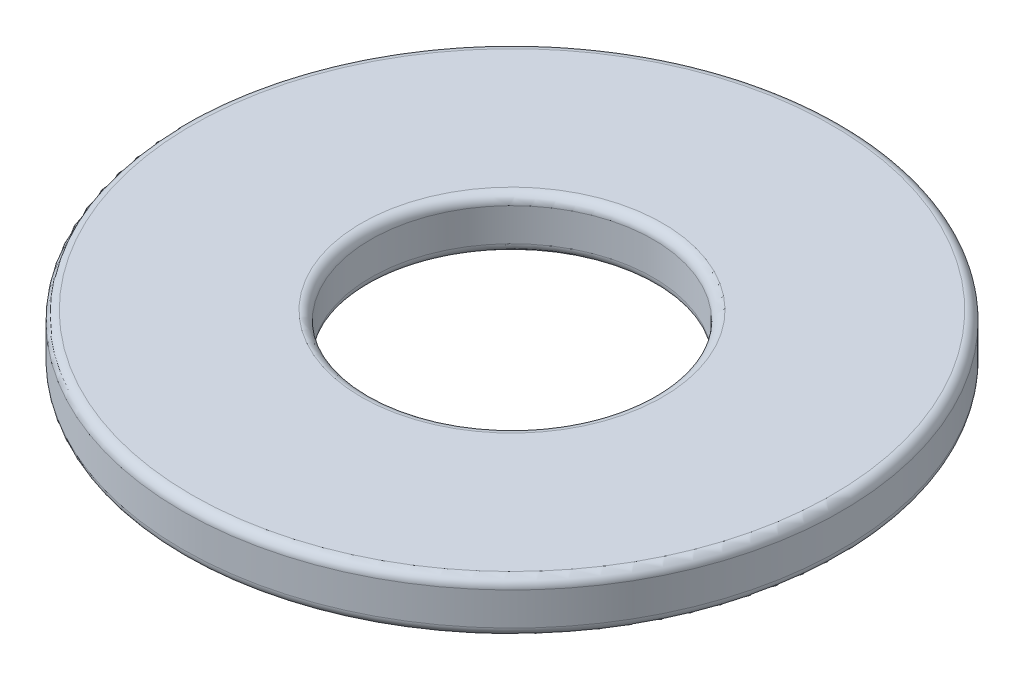
from build123d import *

# Parameters (mm, degrees)
SKETCH1_R           = 3.5
SKETCH1_R_2         = 1.5
BOSS_EXTRUDE1_DEPTH = 0.55
FILLET1_R           = 0.1


with BuildPart() as part:
    # Sketch1 → Boss-Extrude1 (new body)
    with BuildSketch(Plane(origin=(0, 0, 0), x_dir=(1, 0, 0), z_dir=(0, 1, 0))):
        with Locations(Location((0, 0, 0), (0, 0, 270))):
            Circle(SKETCH1_R)
        with Locations(Location((0, 0, 0), (0, 0, 270))):
            Circle(SKETCH1_R_2, mode=Mode.SUBTRACT)
    extrude(amount=BOSS_EXTRUDE1_DEPTH)

    # Fillet1
    fillet1_edges = [part.edges().sort_by_distance(p)[0] for p in [
        (0, 0, -3.5),
        (0, 0.55, -3.5),
        (0, 0, -1.5),
        (0, 0.55, -1.5),
    ]]
    fillet(fillet1_edges, radius=FILLET1_R)


solid = part.part
